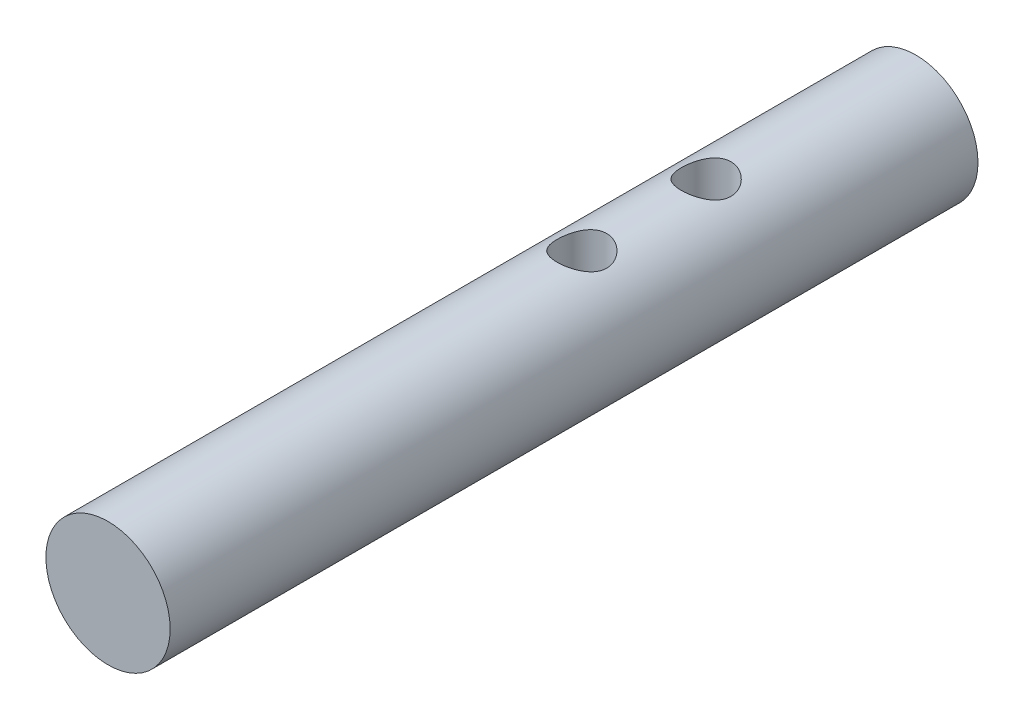
from build123d import *

# Parameters (mm, degrees)
SKETCH_304_R          = 4
EXTRUDE_349_DEPTH     = 52
SKETCH_433_R          = 1.6
CUT_EXTRUDE_540_DEPTH = 53.763623833


with BuildPart() as part:
    # Sketch 304 → Extrude 349 (new body)
    with BuildSketch(Plane.XY):
        Circle(SKETCH_304_R)
    extrude(amount=EXTRUDE_349_DEPTH)

    # Sketch 433 → Cut-Extrude 540 (cut, through all)
    with BuildSketch(Plane(origin=(0, 4, 0), x_dir=(1, 0, 0), z_dir=(0, 1, 0))):
        with Locations((0, -13.5)):
            Circle(SKETCH_433_R)
        with Locations((0, -21.5)):
            Circle(SKETCH_433_R)
    extrude(amount=-CUT_EXTRUDE_540_DEPTH, mode=Mode.SUBTRACT)


solid = part.part
